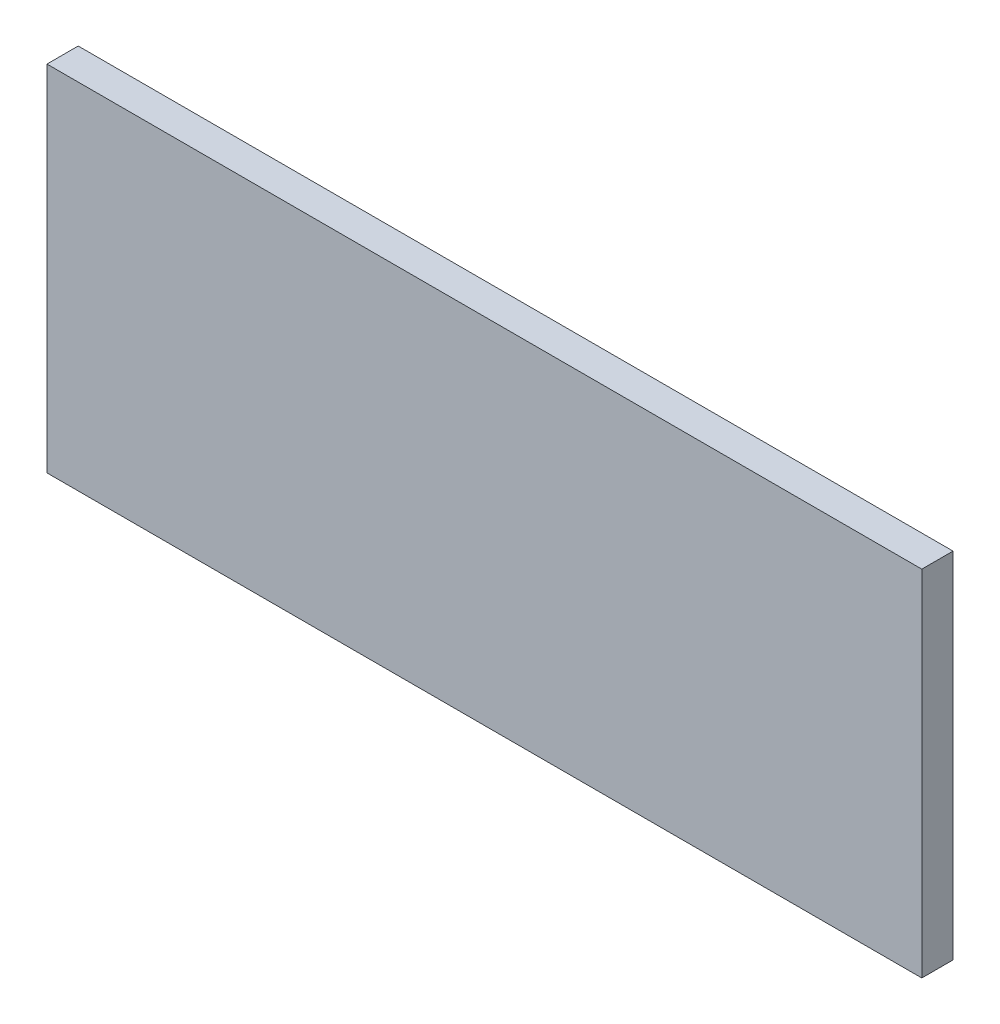
from build123d import *

# Parameters (mm, degrees)
SKETCH1_W           = 168
SKETCH1_H           = 68
BOSS_EXTRUDE1_DEPTH = 6


with BuildPart() as part:
    # Sketch1 → Boss-Extrude1 (new body)
    with BuildSketch(Plane.XY):
        Rectangle(SKETCH1_W, SKETCH1_H)
    extrude(amount=BOSS_EXTRUDE1_DEPTH)


solid = part.part
